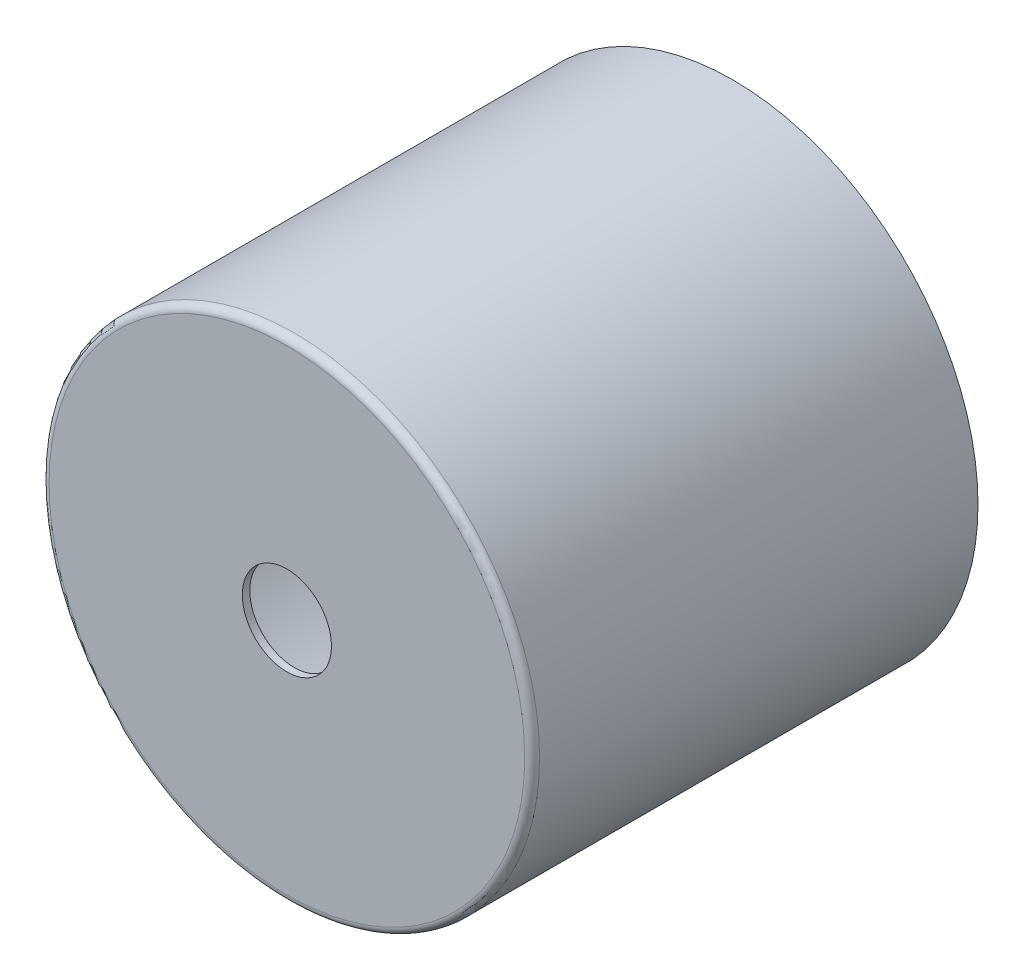
from build123d import *

# Parameters (mm, degrees)
SKETCH1_R           = 16.5
BOSS_EXTRUDE1_DEPTH = 30
SHELL1_T            = -0.5
SKETCH2_R           = 3
CUT_EXTRUDE1_DEPTH  = 39.006578378
FILLET1_R           = 0.5


with BuildPart() as part:
    # Sketch1 → Boss-Extrude1 (new body)
    with BuildSketch(Plane.XY):
        Circle(SKETCH1_R)
    extrude(amount=-BOSS_EXTRUDE1_DEPTH)

    # Shell1
    shell1_openings = [part.faces().sort_by_distance(p)[0] for p in [
        (0, 0, -30),
    ]]
    offset(amount=SHELL1_T, openings=shell1_openings, kind=Kind.INTERSECTION)

    # Sketch2 → Cut-Extrude1 (cut, through all)
    with BuildSketch(Plane.XY):
        Circle(SKETCH2_R)
    extrude(amount=-CUT_EXTRUDE1_DEPTH, mode=Mode.SUBTRACT)

    # Fillet1
    fillet1_edges = [part.edges().sort_by_distance(p)[0] for p in [
        (-16.5, 0, 0),
    ]]
    fillet(fillet1_edges, radius=FILLET1_R)


solid = part.part
